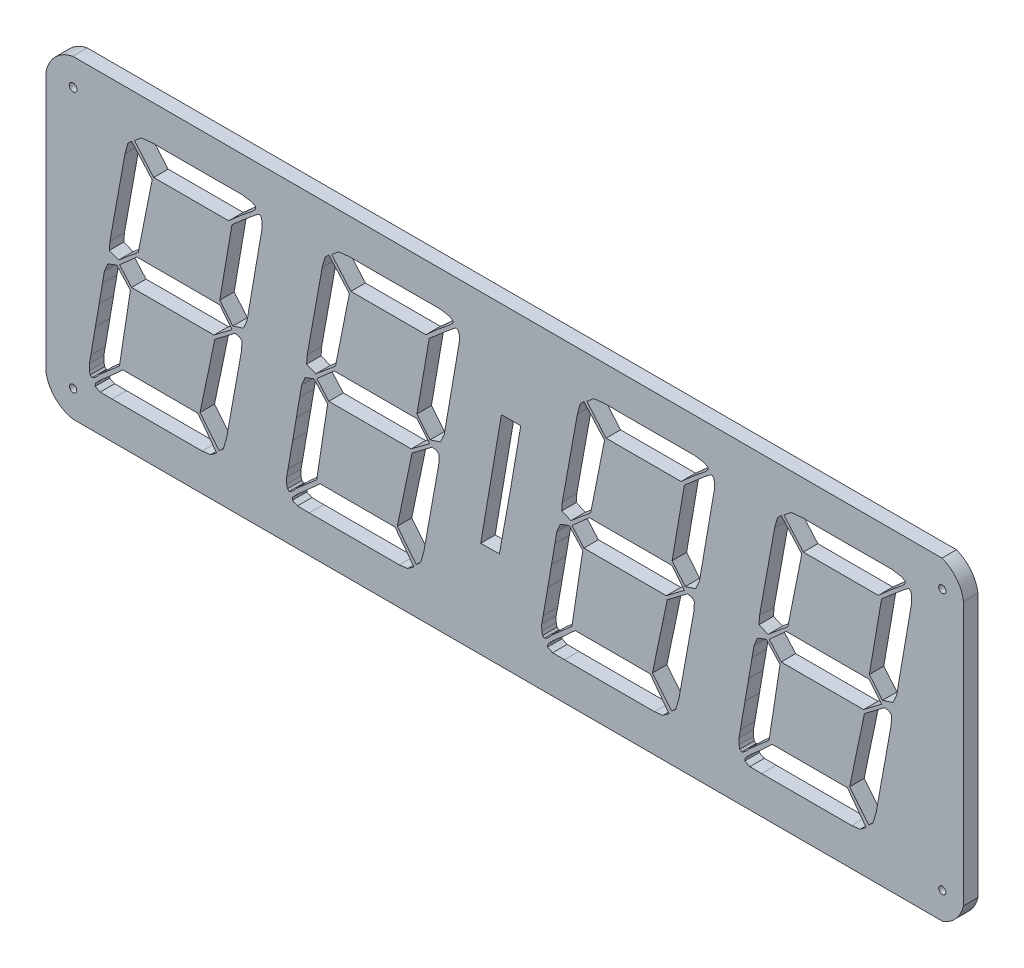
from build123d import *

# Parameters (mm, degrees)
MODEL_R                 = 1.6
MODEL_R_2               = 1.501678921
SALIENTE_EXTRUIR1_DEPTH = 6


with BuildPart() as part:
    # Model → Saliente-Extruir1 (new body)
    with BuildSketch(Plane.XY):
        with BuildLine():
            Line((-140.622549977, 55.752210796), (-140.629925883, -52.247788952))
            ThreePointArc((-140.629925883, -52.247788952), (-136.784404962, -59.478252061), (-129.552217269, -63.320528612))
            Line((-129.552217269, -63.320528612), (230.863125265, -63.332922116))
            ThreePointArc((230.863125265, -63.332922116), (236.323270468, -59.469631582), (239.367964097, -53.514126558))
            Line((239.367964097, -53.514126558), (239.365058989, 55.752210796))
            ThreePointArc((239.365058989, 55.752210796), (236.413672546, 62.4975932), (230.447793161, 66.812584381))
            Line((230.447793161, 66.812584381), (-129.552206627, 66.800218559))
            ThreePointArc((-129.552206627, 66.800218559), (-136.773978307, 62.966224455), (-140.622549977, 55.752210796))
        make_face()
        with Locations((-129.410351241, 55.736840768)):
            Circle(MODEL_R, mode=Mode.SUBTRACT)
        with Locations((-129.410351241, -52.263159232)):
            Circle(MODEL_R_2, mode=Mode.SUBTRACT)
        with Locations((230.589648759, -52.263159232)):
            Circle(MODEL_R_2, mode=Mode.SUBTRACT)
        with Locations((230.589648759, 55.736840768)):
            Circle(MODEL_R_2, mode=Mode.SUBTRACT)
        Polygon((-64.95748133, 40.083826171), (-96.030134596, 40.083826171), (-103.998824933, 49.319820311), (-101.136950269, 51.729086402), (-96.392039417, 52.235139698), (-90.808108124, 52.186165733), (-81.494546692, 52.175943837), (-71.560302407, 52.195098111), (-59.32356459, 52.238175856), (-55.314506175, 51.589867817), (-53.874212458, 50.751629961), (-53.784721686, 49.923939948), (-55.008579435, 48.561995151), (-60.091606451, 44.416598254), align=None, mode=Mode.SUBTRACT)
        Polygon((-110.156165608, 1.736840768), (-102.929955477, 8.080706168), (-68.610434318, 8.080706168), (-63.611855885, 1.736840768), (-71.072304538, -3.936221379), (-105.205405566, -3.936221379), align=None, mode=Mode.SUBTRACT)
        Polygon((-108.828757114, -35.319170042), (-77.756103849, -35.319170042), (-69.950705455, -45.704046557), (-72.497557005, -47.552067334), (-75.985986057, -47.995738989), (-113.294906625, -47.995738989), (-118.168863027, -47.946136935), (-120.2714692, -46.96527154), (-120.133589653, -45.793992752), (-118.03376728, -43.588451318), (-114.025820048, -40.090890003), align=None, mode=Mode.SUBTRACT)
        Polygon((-55.73241736, 46.15978655), (-63.611855886, 39.398868815), (-68.682847803, 9.748352188), (-63.255399949, 3.197840236), (-58.919694936, 4.591867391), (-57.362226688, 8.017134614), (-56.579181076, 12.632575482), (-55.178101289, 20.819110023), (-53.64368338, 29.756618693), (-51.727698933, 40.898731111), (-51.130052863, 44.251975312), (-51.145366139, 46.708724006), (-51.498784043, 48.102657035), (-52.200757799, 48.728376637), (-52.311052168, 48.71914903), (-52.433985182, 48.674653277), (-52.73290221, 48.513674556), (-53.519851591, 47.966257134), align=None, mode=Mode.SUBTRACT)
        Polygon((-105.189617542, 48.561995151), (-96.669549575, 38.950731821), (-102.41153252, 10.057433123), (-110.590302274, 3.197840236), (-114.394568055, 4.748018237), (-114.147499565, 8.141009881), (-107.927587216, 42.670025977), (-106.721863262, 47.016732327), align=None, mode=Mode.SUBTRACT)
        with BuildLine():
            Line((-118.658623856, -41.945282341), (-110.202315217, -34.602636637))
            Line((-110.202315217, -34.602636637), (-105.68208245, -5.136111216))
            Line((-105.68208245, -5.136111216), (-111.331122197, 1.027594144))
            Line((-111.331122197, 1.027594144), (-115.0422443, -0.376226444))
            Line((-115.0422443, -0.376226444), (-116.450089409, -3.803844868))
            Line((-116.450089409, -3.803844868), (-117.233025511, -8.41938095))
            Line((-117.233025511, -8.41938095), (-118.633676835, -16.606201133))
            Line((-118.633676835, -16.606201133), (-120.167557708, -25.544067827))
            Line((-120.167557708, -25.544067827), (-122.082767352, -36.686655829))
            Line((-122.082767352, -36.686655829), (-122.682433536, -40.038621442))
            Line((-122.682433536, -40.038621442), (-122.667546672, -42.49543426))
            Line((-122.667546672, -42.49543426), (-122.313222089, -43.889870019))
            Line((-122.313222089, -43.889870019), (-121.611591608, -44.515086891))
            ThreePointArc((-121.611591608, -44.515086891), (-119.942968883, -43.450971767), (-118.658623856, -41.945282341))
        make_face(mode=Mode.SUBTRACT)
        Polygon((-68.92320561, -44.379086075), (-76.831897203, -34.600207711), (-70.707965519, -5.261200946), (-62.343949774, 1.01544951), (-60.512241678, 0.706425503), (-59.455354907, -0.220646517), (-59.666064306, -3.928934598), (-65.88577313, -38.457362547), (-67.185176354, -42.813699106), align=None, mode=Mode.SUBTRACT)
        Polygon((16.725348189, 40.083826171), (-14.347305076, 40.083826171), (-22.315999304, 49.319820311), (-19.454120749, 51.729086402), (-14.709213787, 52.235139698), (-9.125278604, 52.186165733), (0.188282828, 52.175943837), (10.122527112, 52.195098111), (22.359231203, 52.238175856), (26.368323345, 51.589867817), (27.808617062, 50.751629961), (27.898107833, 49.923939948), (26.674231277, 48.561995151), (21.591223068, 44.416598254), align=None, mode=Mode.SUBTRACT)
        Polygon((-28.473336088, 1.736840768), (-21.247125958, 8.080706168), (13.072395202, 8.080706168), (18.194717653, 1.736840768), (10.610524981, -3.936221379), (-23.522576047, -3.936221379), align=None, mode=Mode.SUBTRACT)
        Polygon((-27.145927594, -35.319170042), (3.926725671, -35.319170042), (11.732075421, -45.704046557), (9.185272515, -47.552067334), (5.696806007, -47.995738989), (-31.612095914, -47.995738989), (-36.486033507, -47.946136935), (-38.588639681, -46.96527154), (-38.450760133, -45.793992752), (-36.350926733, -43.588451318), (-32.342990528, -40.090890003), align=None, mode=Mode.SUBTRACT)
        Polygon((25.950412159, 46.191572327), (18.070973634, 39.430654591), (12.999981716, 9.780137965), (18.427410763, 3.229626013), (22.763134583, 4.623653168), (24.320598941, 8.048920391), (25.103648444, 12.664361259), (26.50472823, 20.8508958), (28.039146139, 29.78840447), (29.955096861, 40.930516888), (30.552776657, 44.283761088), (30.537429654, 46.740509783), (30.184045477, 48.134442812), (29.48207172, 48.760162413), (29.371777352, 48.750934807), (29.248844338, 48.706439054), (28.949927309, 48.545460332), (28.162977928, 47.998042911), align=None, mode=Mode.SUBTRACT)
        Polygon((-23.506788023, 48.593780928), (-14.986720055, 38.982517597), (-20.728703, 10.0892189), (-28.90750648, 3.229626013), (-32.711738536, 4.779804014), (-32.464670045, 8.172795658), (-26.244791423, 42.701811754), (-25.039033743, 47.048518104), align=None, mode=Mode.SUBTRACT)
        with BuildLine():
            Line((-36.975794336, -41.913496564), (-28.519485697, -34.57085086))
            Line((-28.519485697, -34.57085086), (-23.999252931, -5.104325439))
            Line((-23.999252931, -5.104325439), (-29.648326404, 1.059379921))
            Line((-29.648326404, 1.059379921), (-33.359414781, -0.344440667))
            Line((-33.359414781, -0.344440667), (-34.767278698, -3.772059092))
            Line((-34.767278698, -3.772059092), (-35.550195991, -8.387595173))
            Line((-35.550195991, -8.387595173), (-36.950847315, -16.574415356))
            Line((-36.950847315, -16.574415356), (-38.484728189, -25.51228205))
            Line((-38.484728189, -25.51228205), (-40.399956641, -36.654870052))
            Line((-40.399956641, -36.654870052), (-40.999604016, -40.006835665))
            Line((-40.999604016, -40.006835665), (-40.98473596, -42.463648483))
            Line((-40.98473596, -42.463648483), (-40.63039257, -43.858084242))
            Line((-40.63039257, -43.858084242), (-39.928762088, -44.483301114))
            ThreePointArc((-39.928762088, -44.483301114), (-38.260120278, -43.419207921), (-36.975794336, -41.913496564))
        make_face(mode=Mode.SUBTRACT)
        Polygon((12.759623909, -44.347300298), (4.850932317, -34.568421934), (10.974864, -5.229415169), (19.338860937, 1.047235287), (21.170587841, 0.73821128), (22.227474613, -0.18886074), (22.016765213, -3.897148821), (15.796992828, -38.42557677), (14.497653165, -42.781913329), align=None, mode=Mode.SUBTRACT)
        Polygon((122.405550339, 40.259959936), (91.332897074, 40.259959936), (83.36416912, 49.495954077), (86.226081401, 51.905220167), (90.970954637, 52.411273463), (96.554923546, 52.362299498), (105.868484978, 52.352077602), (115.802729262, 52.371231876), (128.039399627, 52.414309622), (132.048525495, 51.766001582), (133.488819212, 50.927763727), (133.578309983, 50.100073713), (132.354414618, 48.738128916), (127.271425218, 44.592732019), align=None, mode=Mode.SUBTRACT)
        Polygon((77.206866062, 1.912974533), (84.360662707, 8.256839933), (118.680183866, 8.256839933), (123.751175784, 1.912974533), (116.290727131, -3.760087614), (82.157626103, -3.760087614), align=None, mode=Mode.SUBTRACT)
        Polygon((78.534274556, -35.143036277), (109.606927821, -35.143036277), (117.412228927, -45.527912792), (114.865474665, -47.375933569), (111.377007996, -47.819605224), (74.068057592, -47.819605224), (69.194168643, -47.77000317), (67.091562469, -46.789137775), (67.229442017, -45.617858987), (69.329226773, -43.412317553), (73.337211622, -39.914756238), align=None, mode=Mode.SUBTRACT)
        Polygon((131.630614309, 46.39949187), (123.751175784, 39.638574134), (118.680183866, 9.988057507), (124.107594104, 3.437545555), (128.443336733, 4.83157271), (130.000797201, 8.256839933), (130.783850594, 12.872280801), (132.18493038, 21.058815342), (133.719348289, 29.996324013), (135.635265285, 41.13843643), (136.232978806, 44.491680631), (136.217598078, 46.948429325), (135.864247627, 48.342362354), (135.16227387, 48.968081956), (135.051979502, 48.95885435), (134.929046488, 48.914358596), (134.630129459, 48.753379875), (133.843180078, 48.205962453), align=None, mode=Mode.SUBTRACT)
        Polygon((82.173414127, 48.80170047), (90.693482095, 39.19043714), (84.95149915, 10.297138442), (76.772691779, 3.437545555), (72.968463614, 4.987723556), (73.215532105, 8.3807152), (79.435377001, 42.909731296), (80.641168407, 47.256437646), align=None, mode=Mode.SUBTRACT)
        with BuildLine():
            Line((68.704407814, -41.705577022), (77.160716453, -34.362931318))
            Line((77.160716453, -34.362931318), (81.680949219, -4.896405897))
            Line((81.680949219, -4.896405897), (76.031871856, 1.267299463))
            Line((76.031871856, 1.267299463), (72.320787369, -0.136521125))
            Line((72.320787369, -0.136521125), (70.912904644, -3.564139549))
            Line((70.912904644, -3.564139549), (70.130006159, -8.179675631))
            Line((70.130006159, -8.179675631), (68.729354835, -16.366495814))
            Line((68.729354835, -16.366495814), (67.195473961, -25.304362508))
            Line((67.195473961, -25.304362508), (65.280226701, -36.44695051))
            Line((65.280226701, -36.44695051), (64.680598134, -39.798916122))
            Line((64.680598134, -39.798916122), (64.695447382, -42.255728941))
            Line((64.695447382, -42.255728941), (65.04980958, -43.6501647))
            Line((65.04980958, -43.6501647), (65.751440062, -44.275381572))
            ThreePointArc((65.751440062, -44.275381572), (67.42008925, -43.211296857), (68.704407814, -41.705577022))
        make_face(mode=Mode.SUBTRACT)
        Polygon((118.439826059, -44.139380755), (110.531134467, -34.360502392), (116.65506615, -5.021495627), (125.019074115, 1.255154829), (126.850789991, 0.946130823), (127.907676763, 0.019058802), (127.696967363, -3.689229279), (121.477161252, -38.217657228), (120.177855315, -42.573993787), align=None, mode=Mode.SUBTRACT)
        Polygon((204.088379858, 40.259959936), (173.015726593, 40.259959936), (165.046979832, 49.495954077), (167.90891092, 51.905220167), (172.653765348, 52.411273463), (178.237753065, 52.362299498), (187.551314497, 52.352077602), (197.485558782, 52.371231876), (209.722210339, 52.414309622), (213.731355014, 51.766001582), (215.171648731, 50.927763727), (215.261139503, 50.100073713), (214.037165658, 48.738128916), (208.954254738, 44.592732019), align=None, mode=Mode.SUBTRACT)
        Polygon((158.889695581, 1.912974533), (165.959295645, 8.256839933), (200.278816804, 8.256839933), (205.434005303, 1.912974533), (197.973556651, -3.760087614), (163.840455623, -3.760087614), align=None, mode=Mode.SUBTRACT)
        Polygon((160.217104075, -35.143036277), (191.28975734, -35.143036277), (199.09509931, -45.527912792), (196.548304184, -47.375933569), (193.059818707, -47.819605224), (155.750898139, -47.819605224), (150.876998162, -47.77000317), (148.774391989, -46.789137775), (148.912271536, -45.617858987), (151.012037484, -43.412317553), (155.020041141, -39.914756238), align=None, mode=Mode.SUBTRACT)
        Polygon((213.313443828, 46.431277646), (205.434005303, 39.67035991), (200.363013386, 10.019843284), (205.790345144, 3.469331332), (210.126166253, 4.863358487), (211.683607913, 8.28862571), (212.466680113, 12.904066578), (213.8677599, 21.090601119), (215.402177809, 30.028109789), (217.318135668, 41.170222207), (217.915808326, 44.523466408), (217.90040879, 46.980215102), (217.547077146, 48.374148131), (216.845103389, 48.999867733), (216.734809021, 48.990640126), (216.611876007, 48.946144373), (216.312958978, 48.785165651), (215.526009598, 48.23774823), align=None, mode=Mode.SUBTRACT)
        Polygon((163.856243647, 48.833486247), (172.376311614, 39.222222916), (166.634328669, 10.328924219), (158.455442819, 3.469331332), (154.651293134, 5.019509333), (154.898361624, 8.412500977), (161.118217548, 42.941517073), (162.323997927, 47.288223423), align=None, mode=Mode.SUBTRACT)
        with BuildLine():
            Line((150.387237333, -41.673791245), (158.843545972, -34.331145541))
            Line((158.843545972, -34.331145541), (163.363778739, -4.86462012))
            Line((163.363778739, -4.86462012), (157.714682567, 1.29908524))
            Line((157.714682567, 1.29908524), (154.003616889, -0.104735348))
            Line((154.003616889, -0.104735348), (152.595715355, -3.532353772))
            Line((152.595715355, -3.532353772), (151.812835678, -8.147889854))
            Line((151.812835678, -8.147889854), (150.412184354, -16.334710037))
            Line((150.412184354, -16.334710037), (148.878303481, -25.272576731))
            Line((148.878303481, -25.272576731), (146.963037412, -36.415164733))
            Line((146.963037412, -36.415164733), (146.363427653, -39.767130346))
            Line((146.363427653, -39.767130346), (146.378258093, -42.223943164))
            Line((146.378258093, -42.223943164), (146.7326391, -43.618378923))
            Line((146.7326391, -43.618378923), (147.434269581, -44.243595795))
            ThreePointArc((147.434269581, -44.243595795), (149.102914443, -43.179506109), (150.387237333, -41.673791245))
        make_face(mode=Mode.SUBTRACT)
        Polygon((200.122655579, -44.107594979), (192.213963986, -34.328716615), (198.33789567, -4.98970985), (206.701884826, 1.286940606), (208.53361951, 0.977916599), (209.590506282, 0.050844579), (209.379796883, -3.657443502), (203.159912292, -38.185871451), (201.860684834, -42.54220801), align=None, mode=Mode.SUBTRACT)
        Polygon((47.141981742, -23.331398583), (39.409572838, -23.403871144), (43.696332571, 1.812955527), (47.983092304, 27.029782198), (55.992010877, 27.053686446), (51.705251144, 1.836859774), align=None, mode=Mode.SUBTRACT)
    extrude(amount=SALIENTE_EXTRUIR1_DEPTH)


solid = part.part
